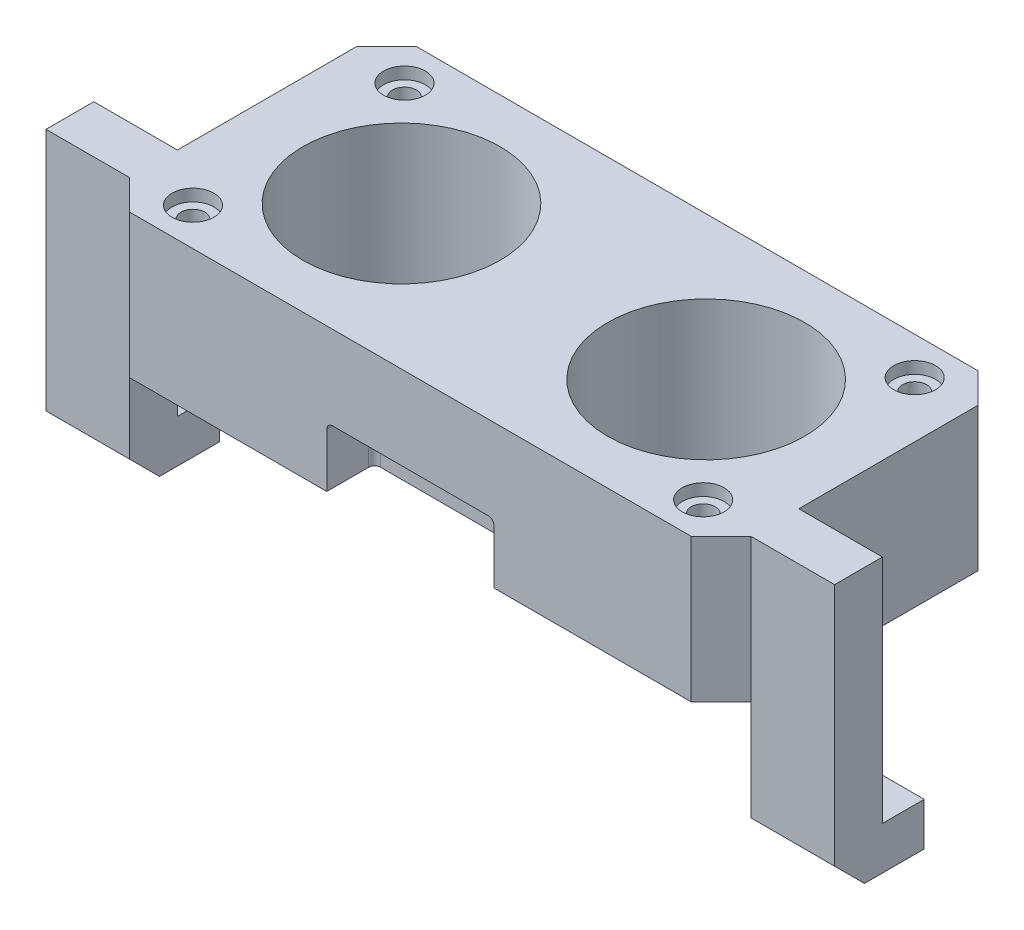
from build123d import *

# Parameters (mm, degrees)
SKETCH1_W           = 52
SKETCH1_H           = 24
SKETCH1_R           = 8.25
BOSS_EXTRUDE1_DEPTH = 12
SKETCH2_R           = 1
CUT_EXTRUDE1_DEPTH  = 32.048349393
SKETCH3_R           = 1.75
CUT_EXTRUDE2_DEPTH  = 1
CUT_EXTRUDE3_DEPTH  = 5
FILLET3_R           = 0.5
CHAMFER1_SIZE       = 2.5
SKETCH5_W           = 14
SKETCH5_H           = 8
CUT_EXTRUDE4_DEPTH  = 5
FILLET4_R           = 0.5
BOSS_EXTRUDE2_DEPTH = 7
BOSS_EXTRUDE3_START = -52
BOSS_EXTRUDE3_DEPTH = 7
CHAMFER2_SIZE       = 2.5


with BuildPart() as part:
    # Sketch1 → Boss-Extrude1 (new body)
    with BuildSketch(Plane(origin=(0, 0, 0), x_dir=(1, 0, 0), z_dir=(0, 1, 0))):
        Rectangle(SKETCH1_W, SKETCH1_H)
        with Locations(Location((12.75, 0, 0), (0, 0, 270))):
            Circle(SKETCH1_R, mode=Mode.SUBTRACT)
        with Locations(Location((-12.75, 0, 0), (0, 0, 270))):
            Circle(SKETCH1_R, mode=Mode.SUBTRACT)
    extrude(amount=BOSS_EXTRUDE1_DEPTH)

    # Sketch2 → Cut-Extrude1 (cut, through all)
    with BuildSketch(Plane(origin=(0, 12, 0), x_dir=(1, 0, 0), z_dir=(0, 1, 0))):
        with Locations(Location((-21.35, 8.85, 0), (0, 0, 270))):
            Circle(SKETCH2_R)
        with Locations(Location((21.35, 8.85, 0), (0, 0, 270))):
            Circle(SKETCH2_R)
        with Locations(Location((21.35, -8.85, 0), (0, 0, 270))):
            Circle(SKETCH2_R)
        with Locations(Location((-21.35, -8.85, 0), (0, 0, 270))):
            Circle(SKETCH2_R)
    extrude(amount=-CUT_EXTRUDE1_DEPTH, mode=Mode.SUBTRACT)

    # Sketch3 → Cut-Extrude2 (cut)
    with BuildSketch(Plane(origin=(0, 12, 0), x_dir=(1, 0, 0), z_dir=(0, 1, 0))):
        with Locations(Location((-21.35, 8.85, 0), (0, 0, 270))):
            Circle(SKETCH3_R)
        with Locations(Location((21.35, 8.85, 0), (0, 0, 270))):
            Circle(SKETCH3_R)
        with Locations(Location((21.35, -8.85, 0), (0, 0, 270))):
            Circle(SKETCH3_R)
        with Locations(Location((-21.35, -8.85, 0), (0, 0, 270))):
            Circle(SKETCH3_R)
    extrude(amount=-CUT_EXTRUDE2_DEPTH, mode=Mode.SUBTRACT)

    # Sketch4 → Cut-Extrude3 (cut)
    with BuildSketch(Plane.XZ):
        Polygon((-6, -5), (-6, -12), (6, -12), (6, -5), (0, -5), align=None)
    extrude(amount=-CUT_EXTRUDE3_DEPTH, mode=Mode.SUBTRACT)

    # Fillet3
    fillet3_edges = [part.edges().sort_by_distance(p)[0] for p in [
        (-6, 2.5, -5),
        (6, 5, -8.5),
        (6, 2.5, -5),
        (-6, 5, -8.5),
        (0, 5, -5),
    ]]
    fillet(fillet3_edges, radius=FILLET3_R)

    # Chamfer1
    chamfer1_edges = [part.edges().sort_by_distance(p)[0] for p in [
        (26, 6, 12),
        (-26, 6, 12),
        (-26, 6, -12),
        (26, 6, -12),
    ]]
    chamfer(chamfer1_edges, length=CHAMFER1_SIZE)

    # Sketch5 → Cut-Extrude4 (cut)
    with BuildSketch(Plane.XZ):
        with Locations((0, 12)):
            Rectangle(SKETCH5_W, SKETCH5_H)
    extrude(amount=-CUT_EXTRUDE4_DEPTH, mode=Mode.SUBTRACT)

    # Fillet4
    fillet4_edges = [part.edges().sort_by_distance(p)[0] for p in [
        (-7, 2.5, 8),
        (7, 5, 10),
        (0, 5, 8),
        (-7, 5, 10),
        (7, 2.5, 8),
    ]]
    fillet(fillet4_edges, radius=FILLET4_R)

    # Sketch6 → Boss-Extrude2 (add)
    with BuildSketch(Plane(origin=(26, 0, 0), x_dir=(0, 0, -1), z_dir=(1, 0, 0))):
        Polygon((-5.5, 0), (-5.5, 12), (-9.5, 12), (-9.5, -10.909520595), (-2, -10.909520595), (-2, -7.309520595), (-5.5, -7.309520595), align=None)
    extrude(amount=BOSS_EXTRUDE2_DEPTH)

    # Sketch6<2> → Boss-Extrude3 (add)
    with BuildSketch(Plane(origin=(26, 0, 0), x_dir=(0, 0, -1), z_dir=(1, 0, 0)).offset(BOSS_EXTRUDE3_START)):
        Polygon((-5.5, 0), (-5.5, 12), (-9.5, 12), (-9.5, -10.909520595), (-2, -10.909520595), (-2, -7.309520595), (-5.5, -7.309520595), align=None)
    extrude(amount=-BOSS_EXTRUDE3_DEPTH)

    # Chamfer2
    chamfer2_edges = [part.edges().sort_by_distance(p)[0] for p in [
        (29.5, -10.909520595, 9.5),
        (-29.5, -10.909520595, 9.5),
    ]]
    chamfer(chamfer2_edges, length=CHAMFER2_SIZE)


solid = part.part
